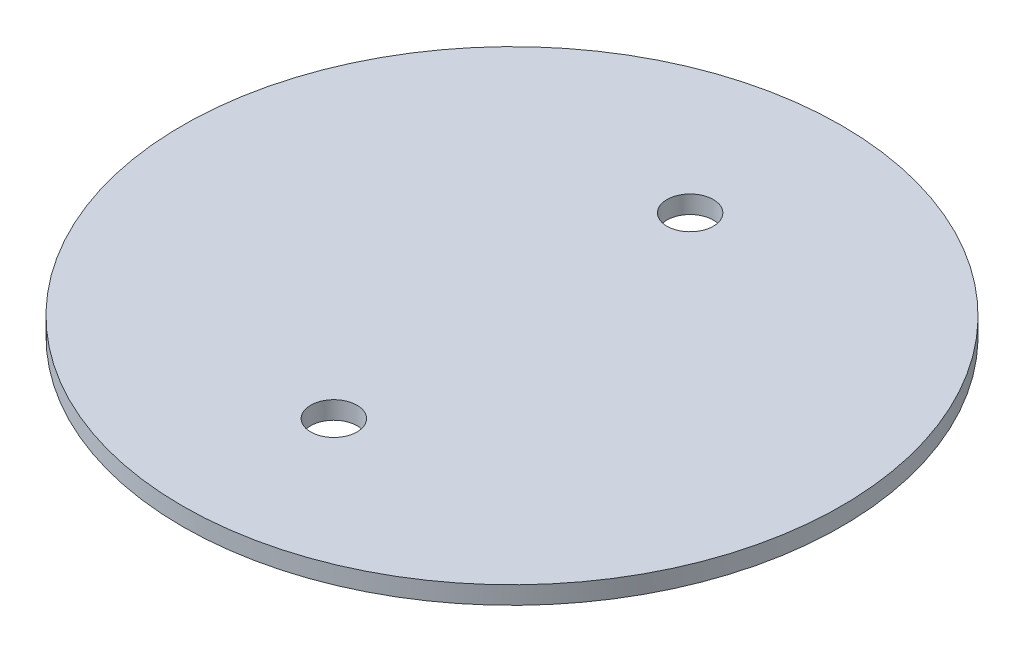
from build123d import *

# Parameters (mm, degrees)
SKETCH1_R           = 37
BOSS_EXTRUDE1_DEPTH = 2
SKETCH2_R           = 2.6
CUT_EXTRUDE1_DEPTH  = 3


with BuildPart() as part:
    # Sketch1 → Boss-Extrude1 (new body)
    with BuildSketch(Plane(origin=(0, 0, 0), x_dir=(1, 0, 0), z_dir=(0, 1, 0))):
        with Locations(Location((0, 0, 0), (0, 0, 270))):
            Circle(SKETCH1_R)
    extrude(amount=BOSS_EXTRUDE1_DEPTH)

    # Sketch2 → Cut-Extrude1 (cut)
    with BuildSketch(Plane(origin=(0, 2, 0), x_dir=(1, 0, 0), z_dir=(0, 1, 0))):
        with Locations(Location((0, 20, 0), (0, 0, 270))):
            Circle(SKETCH2_R)
        with Locations(Location((0, -20, 0), (0, 0, 270))):
            Circle(SKETCH2_R)
    extrude(amount=-CUT_EXTRUDE1_DEPTH, mode=Mode.SUBTRACT)


solid = part.part
